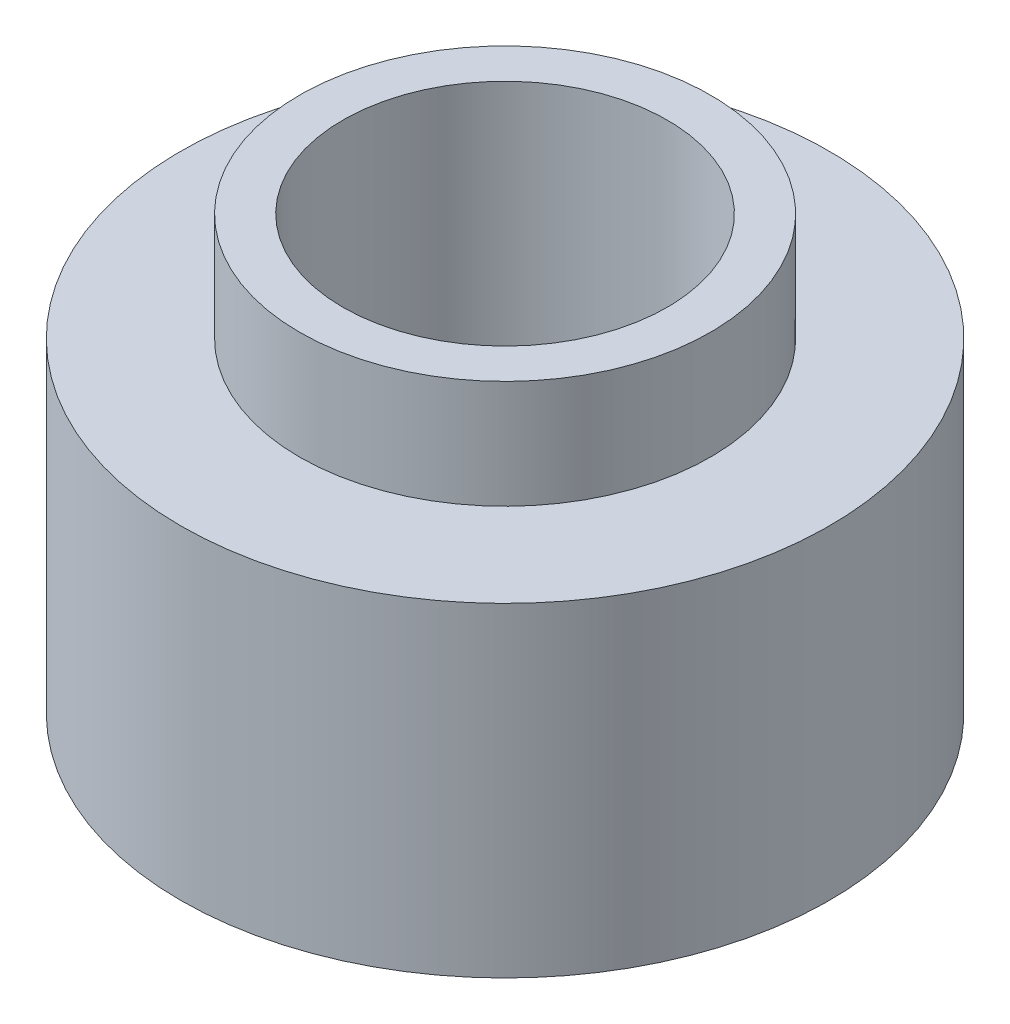
from build123d import *

# Parameters (mm, degrees)
SKETCH1_R           = 0.375
BOSS_EXTRUDE2_DEPTH = 0.375
SKETCH3_R           = 0.1875
CUT_EXTRUDE1_DEPTH  = 0.375
SKETCH4_R           = 0.2375
BOSS_EXTRUDE3_DEPTH = 0.125
SKETCH5_R           = 0.1875
CUT_EXTRUDE2_DEPTH  = 0.125


with BuildPart() as part:
    # Sketch1 → Boss-Extrude2 (new body)
    with BuildSketch(Plane(origin=(0, 0, 0), x_dir=(1, 0, 0), z_dir=(0, 1, 0))):
        with Locations(Location((0, 0, 0), (0, 0, 270))):
            Circle(SKETCH1_R)
    extrude(amount=BOSS_EXTRUDE2_DEPTH)

    # Sketch3 → Cut-Extrude1 (cut)
    with BuildSketch(Plane(origin=(0, 0.375, 0), x_dir=(1, 0, 0), z_dir=(0, 1, 0))):
        with Locations(Location((0, 0, 0), (0, 0, 270))):
            Circle(SKETCH3_R)
    extrude(amount=-CUT_EXTRUDE1_DEPTH, mode=Mode.SUBTRACT)

    # Sketch4 → Boss-Extrude3 (add)
    with BuildSketch(Plane(origin=(0, 0.375, 0), x_dir=(1, 0, 0), z_dir=(0, 1, 0))):
        with Locations(Location((0, 0, 0), (0, 0, 270))):
            Circle(SKETCH4_R)
    extrude(amount=BOSS_EXTRUDE3_DEPTH)

    # Sketch5 → Cut-Extrude2 (cut)
    with BuildSketch(Plane(origin=(0, 0.5, 0), x_dir=(1, 0, 0), z_dir=(0, 1, 0))):
        with Locations(Location((0, 0, 0), (0, 0, 270))):
            Circle(SKETCH5_R)
    extrude(amount=-CUT_EXTRUDE2_DEPTH, mode=Mode.SUBTRACT)


solid = part.part
